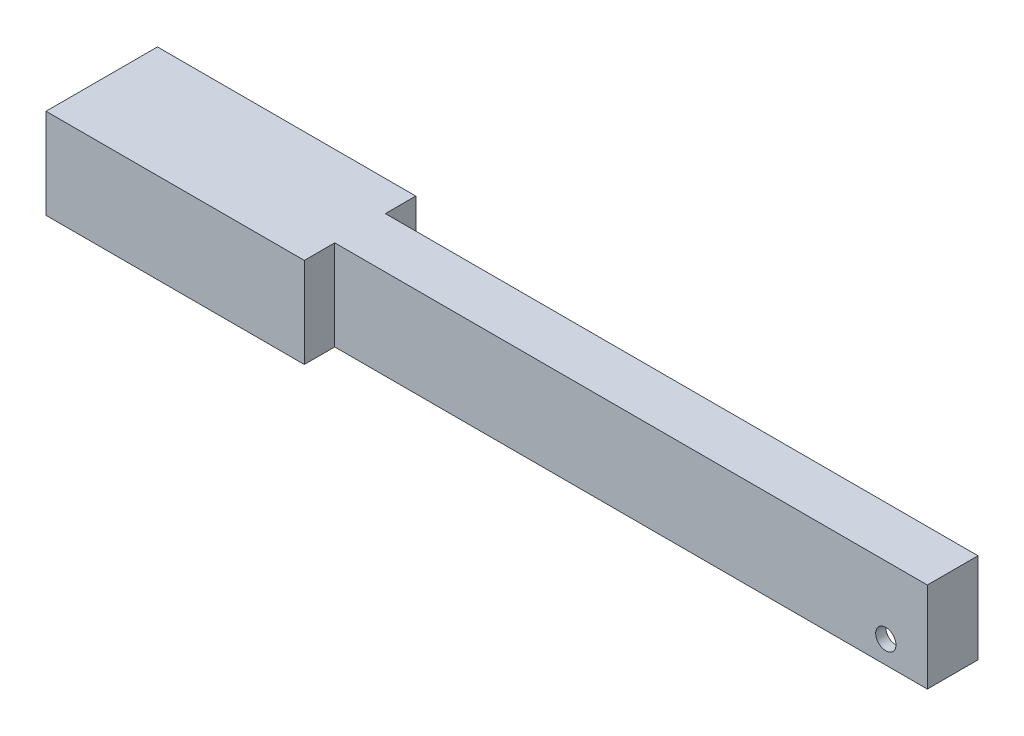
from build123d import *

# Parameters (mm, degrees)
SKETCH1_W           = 168
SKETCH1_H           = 22
BOSS_EXTRUDE1_DEPTH = 17.8
SKETCH8_R           = 2
CUT_EXTRUDE4_DEPTH  = 22
CUT_EXTRUDE2_REACH  = 88.567
SKETCH5_W           = 117
SKETCH5_H           = 6
CUT_EXTRUDE3_DEPTH  = 15.8
BOSS_EXTRUDE3_REACH = 90.164
SKETCH7_W           = 47
SKETCH7_H           = 2


with BuildPart() as part:
    # Sketch1 → Boss-Extrude1 (new body)
    with BuildSketch(Plane(origin=(0, 0, 0), x_dir=(1, 0, 0), z_dir=(0, 1, 0))):
        Rectangle(SKETCH1_W, SKETCH1_H)
    extrude(amount=-BOSS_EXTRUDE1_DEPTH)

    # Sketch8 → Cut-Extrude4 (cut)
    with BuildSketch(Plane.XY.offset(11)):
        with Locations((75.8, -13.35)):
            Circle(SKETCH8_R)
    extrude(amount=-CUT_EXTRUDE4_DEPTH, mode=Mode.SUBTRACT)

    # Cut-Extrude2: up to this face of the body (flat: up to its plane)
    cut_extrude2_end = Plane(part.part.faces().sort_by_distance((0, -17.8, 0))[0])
    # Sketch5 → Cut-Extrude2 (cut, up to the picked face)
    with BuildSketch(Plane(origin=(0, 0, 0), x_dir=(1, 0, 0), z_dir=(0, 1, 0)), mode=Mode.PRIVATE) as cut_extrude2_sk1:
        with Locations((25.5, 8)):
            Rectangle(SKETCH5_W, SKETCH5_H)
    cut_extrude2_tool1 = split(extrude(cut_extrude2_sk1.sketch, amount=-CUT_EXTRUDE2_REACH, mode=Mode.PRIVATE), bisect_by=cut_extrude2_end, keep=Keep.BOTH, mode=Mode.PRIVATE)
    # Sketch5 → Cut-Extrude2 (cut, up to the picked face)
    with BuildSketch(Plane(origin=(0, 0, 0), x_dir=(1, 0, 0), z_dir=(0, 1, 0)), mode=Mode.PRIVATE) as cut_extrude2_sk2:
        with Locations((25.5, -8)):
            Rectangle(SKETCH5_W, SKETCH5_H)
    cut_extrude2_tool2 = split(extrude(cut_extrude2_sk2.sketch, amount=-CUT_EXTRUDE2_REACH, mode=Mode.PRIVATE), bisect_by=cut_extrude2_end, keep=Keep.BOTH, mode=Mode.PRIVATE)
    add(cut_extrude2_tool1.solids().sort_by(Axis((25.5, 0, -8), (0, -1, 0)))[0], mode=Mode.SUBTRACT)
    add(cut_extrude2_tool2.solids().sort_by(Axis((25.5, 0, 8), (0, -1, 0)))[0], mode=Mode.SUBTRACT)

    # Sketch6 → Cut-Extrude3 (cut)
    with BuildSketch(Plane.XZ.offset(17.8)):
        Polygon((-82, 9), (-82, -9), (-35, -9), (-35, -3), (82, -3), (82, 3), (-35, 3), (-35, 9), align=None)
    extrude(amount=-CUT_EXTRUDE3_DEPTH, mode=Mode.SUBTRACT)

    # Boss-Extrude3: up to this face of the body (flat: up to its plane)
    boss_extrude3_end = Plane(part.part.faces().sort_by_distance((-58.5, -9.9, 9))[0])
    # Sketch7 → Boss-Extrude3 (add, up to the picked face)
    with BuildSketch(Plane.XY.offset(-9), mode=Mode.PRIVATE) as boss_extrude3_sk1:
        with Locations((-58.5, -13.3)):
            Rectangle(SKETCH7_W, SKETCH7_H)
    boss_extrude3_tool1 = split(extrude(boss_extrude3_sk1.sketch, amount=BOSS_EXTRUDE3_REACH, mode=Mode.PRIVATE), bisect_by=boss_extrude3_end, keep=Keep.BOTH, mode=Mode.PRIVATE)
    add(boss_extrude3_tool1.solids().sort_by(Axis((-58.5, -13.3, -9), (0, 0, 1)))[0])


solid = part.part
